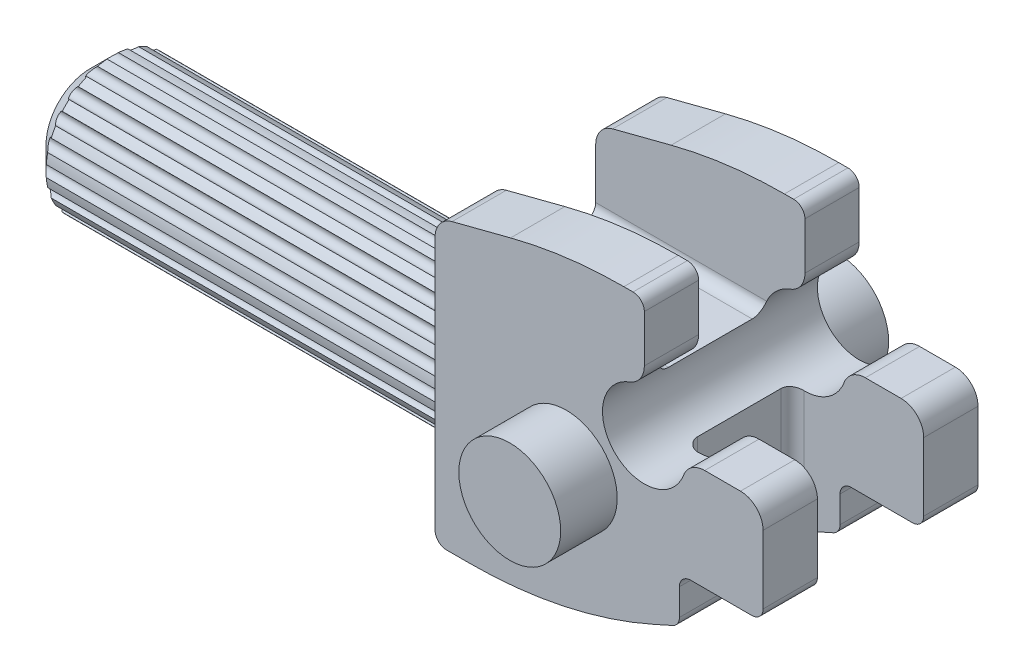
from build123d import *

# Parameters (mm, degrees)
SKETCH1_W           = 14.5
SKETCH1_H           = 9.5
BOSS_EXTRUDE1_DEPTH = 14
SKETCH2_R           = 2.25
BOSS_EXTRUDE2_DEPTH = 2.5
CUT_EXTRUDE1_REACH  = 21.813
SKETCH3_R           = 1.85
FILLET1_R           = 1
FILLET2_R           = 20
FILLET3_R           = 0.5
SKETCH4_W           = 4.7
SKETCH4_H           = 14
CUT_EXTRUDE2_DEPTH  = 5.8
SKETCH5_W           = 8.7
SKETCH5_H           = 4.7
CUT_EXTRUDE3_DEPTH  = 5
SKETCH6_R           = 2.95
BOSS_EXTRUDE3_DEPTH = 20
CHAMFER1_SIZE       = 1
SKETCH7_R           = 0.25
CUT_EXTRUDE4_DEPTH  = 20
FILLET4_R           = 0.5


with BuildPart() as part:
    # Sketch1 → Boss-Extrude1 (new body)
    with BuildSketch(Plane(origin=(0, 0, 0), x_dir=(1, 0, 0), z_dir=(0, 1, 0))):
        Rectangle(SKETCH1_W, SKETCH1_H)
    extrude(amount=BOSS_EXTRUDE1_DEPTH)

    # Sketch2 → Boss-Extrude2 (add)
    with BuildSketch(Plane.XY.offset(4.75)):
        with Locations(Location((-1.45, 5.75, 0), (0, 0, 180))):
            Circle(SKETCH2_R)
    boss_extrude2 = extrude(amount=BOSS_EXTRUDE2_DEPTH)

    # Mirror1: Boss-Extrude2 across plane
    add(boss_extrude2.mirror(Plane.XY))

    # Sketch3 → Cut-Extrude1 (cut, up to next)
    with BuildSketch(Plane.XY.offset(4.75), mode=Mode.PRIVATE) as cut_extrude1_sk1:
        Polygon((-7.25, 14), (-7.25, 12.5), (-1.45, 14), align=None)
    cut_extrude1_tool1 = extrude(cut_extrude1_sk1.sketch, amount=-CUT_EXTRUDE1_REACH, mode=Mode.PRIVATE) & part.part
    # Sketch3 → Cut-Extrude1 (cut, up to next)
    with BuildSketch(Plane.XY.offset(4.75), mode=Mode.PRIVATE) as cut_extrude1_sk2:
        with BuildLine():
            Line((3.85, 8.75), (7.25, 8.75))
            Line((7.25, 8.75), (7.25, 14))
            Line((7.25, 14), (2, 14))
            Line((2, 14), (2, 10.6))
            ThreePointArc((2, 10.6), (3.308147545, 10.058147545), (3.85, 8.75))
        make_face()
    cut_extrude1_tool2 = extrude(cut_extrude1_sk2.sketch, amount=-CUT_EXTRUDE1_REACH, mode=Mode.PRIVATE) & part.part
    # Sketch3 → Cut-Extrude1 (cut, up to next)
    with BuildSketch(Plane.XY.offset(4.75), mode=Mode.PRIVATE) as cut_extrude1_sk3:
        with Locations((2, 8.75)):
            Circle(SKETCH3_R)
    cut_extrude1_tool3 = extrude(cut_extrude1_sk3.sketch, amount=-CUT_EXTRUDE1_REACH, mode=Mode.PRIVATE) & part.part
    # Sketch3 → Cut-Extrude1 (cut, up to next)
    with BuildSketch(Plane.XY.offset(4.75), mode=Mode.PRIVATE) as cut_extrude1_sk4:
        Polygon((7.25, 0), (7.25, 4.24), (3.55, 4.24), (3.55, 2.24), (-1.45, 0), align=None)
    cut_extrude1_tool4 = extrude(cut_extrude1_sk4.sketch, amount=-CUT_EXTRUDE1_REACH, mode=Mode.PRIVATE) & part.part
    add(cut_extrude1_tool1.solids().sort_by_distance((-5.316667, 13.5, 4.75))[0], mode=Mode.SUBTRACT)
    add(cut_extrude1_tool2.solids().sort_by_distance((4.823819, 11.573819, 4.75))[0], mode=Mode.SUBTRACT)
    add(cut_extrude1_tool3.solids().sort_by_distance((2, 8.75, 4.75))[0], mode=Mode.SUBTRACT)
    add(cut_extrude1_tool4.solids().sort_by_distance((4.474909, 1.758732, 4.75))[0], mode=Mode.SUBTRACT)

    # Fillet1
    fillet1_edges = [part.edges().sort_by_distance(p)[0] for p in [
        (-7.25, 12.5, 0),
        (2, 10.6, 0),
        (7.25, 8.75, 0),
        (3.85, 8.75, 0),
    ]]
    fillet(fillet1_edges, radius=FILLET1_R)

    # Fillet2
    fillet2_edges = [part.edges().sort_by_distance(p)[0] for p in [
        (-1.45, 14, 0),
        (-1.45, 0, 0),
    ]]
    fillet(fillet2_edges, radius=FILLET2_R)

    # Fillet3
    fillet3_edges = [part.edges().sort_by_distance(p)[0] for p in [
        (2, 14, 0),
        (-7.25, 0, 0),
        (3.55, 2.24, 0),
        (3.55, 4.24, 0),
        (7.25, 4.24, 0),
    ]]
    fillet(fillet3_edges, radius=FILLET3_R)

    # Sketch4 → Cut-Extrude2 (cut)
    with BuildSketch(Plane(origin=(7.25, 0, 0), x_dir=(0, 0, -1), z_dir=(1, 0, 0))):
        with Locations((0, 7)):
            Rectangle(SKETCH4_W, SKETCH4_H)
    extrude(amount=-CUT_EXTRUDE2_DEPTH, mode=Mode.SUBTRACT)

    # Sketch5 → Cut-Extrude3 (cut)
    with BuildSketch(Plane(origin=(0, 14, 0), x_dir=(1, 0, 0), z_dir=(0, 1, 0))):
        with Locations((-2.9, 0)):
            Rectangle(SKETCH5_W, SKETCH5_H)
    extrude(amount=-CUT_EXTRUDE3_DEPTH, mode=Mode.SUBTRACT)

    # Sketch6 → Boss-Extrude3 (add)
    with BuildSketch(Plane.ZY.offset(7.25)):
        with Locations(Location((0, 3.85, 0), (0, 0, 180))):
            Circle(SKETCH6_R)
    extrude(amount=BOSS_EXTRUDE3_DEPTH)

    # Chamfer1
    chamfer1_edges = [part.edges().sort_by_distance(p)[0] for p in [
        (-27.25, 3.85, 2.95),
    ]]
    chamfer(chamfer1_edges, length=CHAMFER1_SIZE)

    # Sketch7 → Cut-Extrude4 (cut)
    with BuildSketch(Plane.ZY.offset(27.25)):
        with Locations((0, 6.8)):
            Circle(SKETCH7_R)
        with Locations((0.911600133, 6.655616723)):
            Circle(SKETCH7_R)
        with Locations((1.733966494, 6.236600133)):
            Circle(SKETCH7_R)
        with Locations((2.386600133, 5.583966494)):
            Circle(SKETCH7_R)
        with Locations((2.805616723, 4.761600133)):
            Circle(SKETCH7_R)
        with Locations((2.95, 3.85)):
            Circle(SKETCH7_R)
        with Locations((2.805616723, 2.938399867)):
            Circle(SKETCH7_R)
        with Locations((2.386600133, 2.116033506)):
            Circle(SKETCH7_R)
        with Locations((1.733966494, 1.463399867)):
            Circle(SKETCH7_R)
        with Locations((0.911600133, 1.044383277)):
            Circle(SKETCH7_R)
        with Locations((0, 0.9)):
            Circle(SKETCH7_R)
        with Locations((-0.911600133, 1.044383277)):
            Circle(SKETCH7_R)
        with Locations((-1.733966494, 1.463399867)):
            Circle(SKETCH7_R)
        with Locations((-2.386600133, 2.116033506)):
            Circle(SKETCH7_R)
        with Locations((-2.805616723, 2.938399867)):
            Circle(SKETCH7_R)
        with Locations((-2.95, 3.85)):
            Circle(SKETCH7_R)
        with Locations((-2.805616723, 4.761600133)):
            Circle(SKETCH7_R)
        with Locations((-2.386600133, 5.583966494)):
            Circle(SKETCH7_R)
        with Locations((-1.733966494, 6.236600133)):
            Circle(SKETCH7_R)
        with Locations((-0.911600133, 6.655616723)):
            Circle(SKETCH7_R)
    extrude(amount=-CUT_EXTRUDE4_DEPTH, mode=Mode.SUBTRACT)

    # Fillet4
    fillet4_edges = [part.edges().sort_by_distance(p)[0] for p in [
        (1.45, 4.157541993, -2.35),
        (1.45, 4.157541993, 2.35),
        (-3.541515139, 9, 2.35),
        (-3.541515139, 9, -2.35),
    ]]
    fillet(fillet4_edges, radius=FILLET4_R)


solid = part.part
